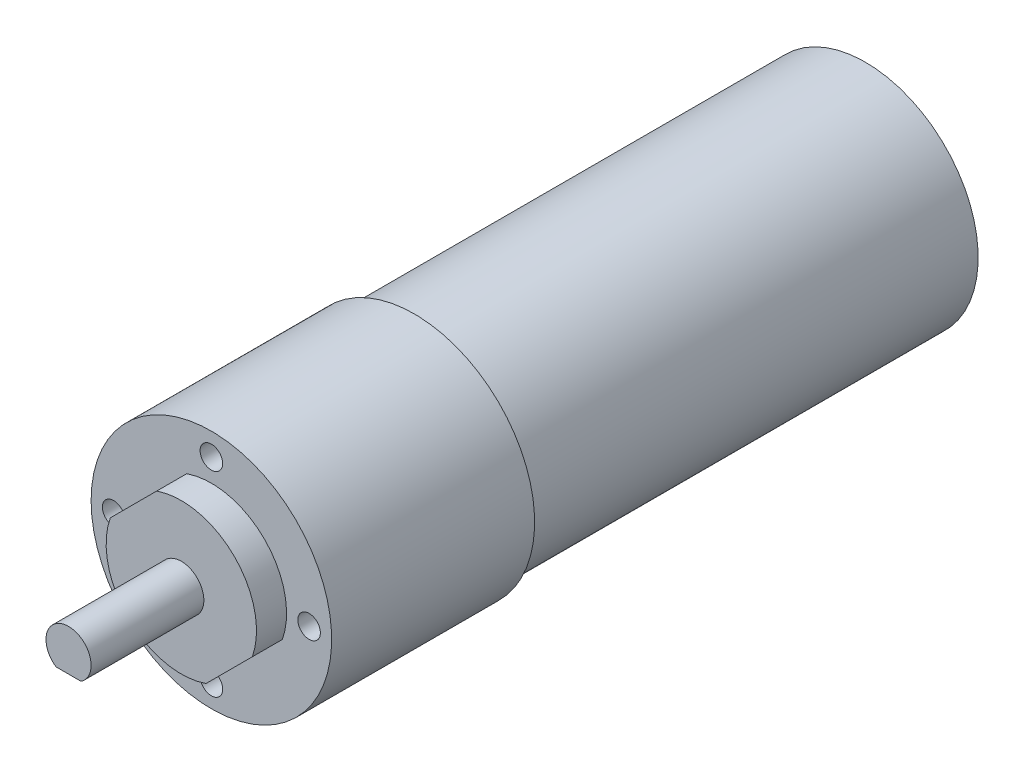
from build123d import *

# Parameters (mm, degrees)
SKETCH1_R           = 3
BOSS_EXTRUDE1_DEPTH = 15
CUT_EXTRUDE2_START  = -12
CUT_EXTRUDE2_DEPTH  = 12
SKETCH3_R           = 10
BOSS_EXTRUDE2_DEPTH = 4
CUT_EXTRUDE3_REACH  = 25.685
SKETCH5_R           = 16
BOSS_EXTRUDE3_DEPTH = 27
SKETCH6_R           = 15
BOSS_EXTRUDE4_DEPTH = 60
SKETCH9_R           = 1.5
CUT_EXTRUDE4_DEPTH  = 5


with BuildPart() as part:
    # Sketch1 → Boss-Extrude1 (new body)
    with BuildSketch(Plane.XY):
        Circle(SKETCH1_R)
    extrude(amount=BOSS_EXTRUDE1_DEPTH)

    # Sketch2 → Cut-Extrude2 (cut)
    with BuildSketch(Plane.XY.offset(15).offset(CUT_EXTRUDE2_START)):
        with BuildLine():
            Line((1.658312395, -2.5), (-1.658312395, -2.5))
            ThreePointArc((-1.658312395, -2.5), (0, -3), (1.658312395, -2.5))
        make_face()
    extrude(amount=CUT_EXTRUDE2_DEPTH, mode=Mode.SUBTRACT)

    # Sketch3 → Boss-Extrude2 (add)
    with BuildSketch(Plane(origin=(0, 0, 0), x_dir=(-1, 0, 0), z_dir=(0, 0, -1))):
        Circle(SKETCH3_R)
    extrude(amount=BOSS_EXTRUDE2_DEPTH)

    # Sketch4 → Cut-Extrude3 (cut, up to next)
    with BuildSketch(Plane(origin=(0, 0, -4), x_dir=(-1, 0, 0), z_dir=(0, 0, -1)), mode=Mode.PRIVATE) as cut_extrude3_sk1:
        with BuildLine():
            Line((-3.281754029, -9.446168032), (-9.446168032, -3.281754029))
            ThreePointArc((-9.446168032, -3.281754029), (-7.071067812, -7.071067812), (-3.281754029, -9.446168032))
        make_face()
    cut_extrude3_tool1 = extrude(cut_extrude3_sk1.sketch, amount=-CUT_EXTRUDE3_REACH, mode=Mode.PRIVATE) & part.part
    # Sketch4 → Cut-Extrude3 (cut, up to next)
    with BuildSketch(Plane(origin=(0, 0, -4), x_dir=(-1, 0, 0), z_dir=(0, 0, -1)), mode=Mode.PRIVATE) as cut_extrude3_sk2:
        with BuildLine():
            ThreePointArc((9.446168032, 3.281754029), (7.071067812, 7.071067812), (3.281754029, 9.446168032))
            Line((3.281754029, 9.446168032), (9.446168032, 3.281754029))
        make_face()
    cut_extrude3_tool2 = extrude(cut_extrude3_sk2.sketch, amount=-CUT_EXTRUDE3_REACH, mode=Mode.PRIVATE) & part.part
    add(cut_extrude3_tool1.solids().sort_by_distance((6.648052, -6.648052, -4))[0], mode=Mode.SUBTRACT)
    add(cut_extrude3_tool2.solids().sort_by_distance((-6.648052, 6.648052, -4))[0], mode=Mode.SUBTRACT)

    # Sketch5 → Boss-Extrude3 (add)
    with BuildSketch(Plane(origin=(0, 0, -4), x_dir=(-1, 0, 0), z_dir=(0, 0, -1))):
        Circle(SKETCH5_R)
    extrude(amount=BOSS_EXTRUDE3_DEPTH)

    # Sketch6 → Boss-Extrude4 (add)
    with BuildSketch(Plane(origin=(0, 0, -31), x_dir=(-1, 0, 0), z_dir=(0, 0, -1))):
        Circle(SKETCH6_R)
    extrude(amount=BOSS_EXTRUDE4_DEPTH)

    # Sketch9 → Cut-Extrude4 (cut)
    with BuildSketch(Plane.XY.offset(-4)):
        with Locations((0, 13)):
            Circle(SKETCH9_R)
        with Locations((13, 0)):
            Circle(SKETCH9_R)
        with Locations((0, -13)):
            Circle(SKETCH9_R)
        with Locations((-13, 0)):
            Circle(SKETCH9_R)
    extrude(amount=-CUT_EXTRUDE4_DEPTH, mode=Mode.SUBTRACT)


solid = part.part
